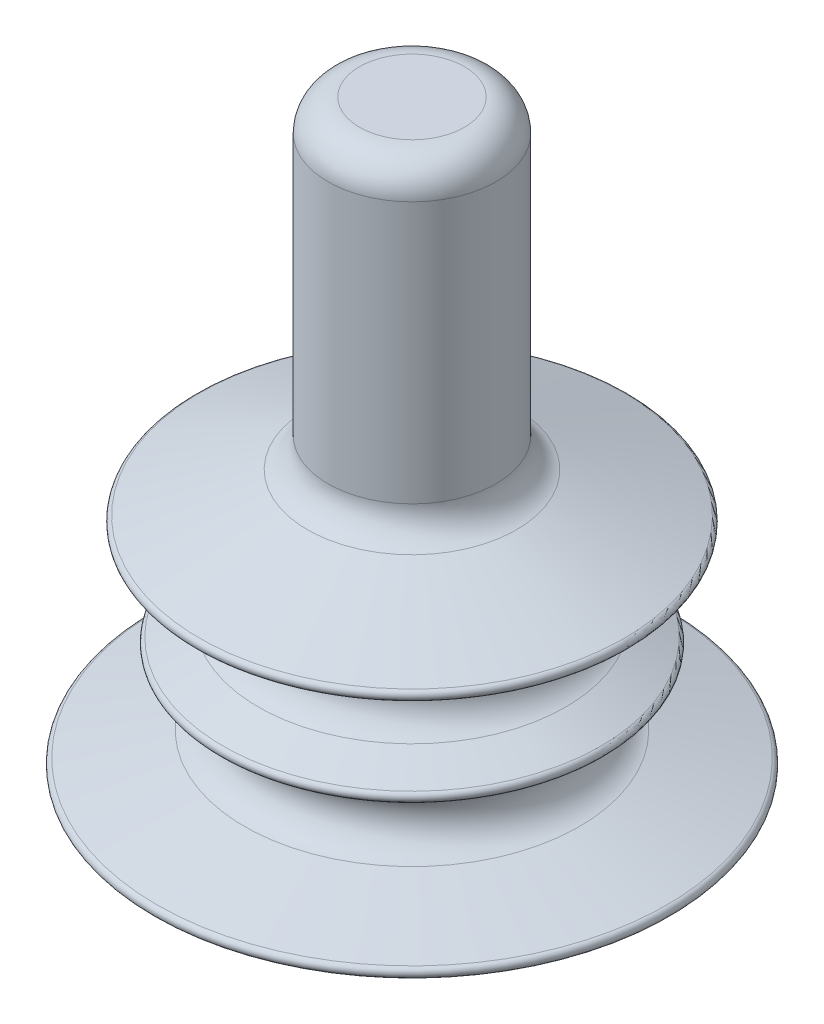
from build123d import *

# Parameters (mm, degrees)
FILETE1_R = 3


with BuildPart() as part:
    # Esboço1 → Revolução1 (revolve)
    with BuildSketch(Plane(origin=(0, 0, 0), x_dir=(0, 0, -1), z_dir=(1, 0, 0)), mode=Mode.PRIVATE) as revolu_o1_sk:
        with BuildLine():
            Line((0, 65), (-8, 65))
            Line((-8, 65), (-8, 35))
            Line((-8, 35), (-20.234039173, 30.46887438))
            ThreePointArc((-20.234039173, 30.46887438), (-20.560381995, 30), (-20.234039173, 29.53112562))
            Line((-20.234039173, 29.53112562), (-8, 25))
            Line((-8, 25), (-17.998596875, 20.455183239))
            ThreePointArc((-17.998596875, 20.455183239), (-18.291695403, 20), (-17.998596875, 19.544816761))
            Line((-17.998596875, 19.544816761), (-8, 15))
            Line((-8, 15), (-24.265667763, 10.481758955))
            ThreePointArc((-24.265667763, 10.481758955), (-24.631845831, 10), (-24.265667763, 9.518241045))
            Line((-24.265667763, 9.518241045), (-8, 5))
            Line((-8, 5), (-8, 0))
            Line((-8, 0), (0, 0))
            Line((0, 0), (0, 65))
        make_face()
    revolve(revolu_o1_sk.sketch.rotate(Axis((0, 0, 0), (0, 1, 0)), 180), axis=Axis((0, 0, 0), (0, 1, 0)))

    # Filete1
    filete1_edges = [part.edges().sort_by_distance(p)[0] for p in [
        (0, 5, 8),
        (0, 15, 8),
        (0, 25, 8),
        (0, 35, 8),
        (0, 65, 8),
    ]]
    fillet(filete1_edges, radius=FILETE1_R)


solid = part.part
